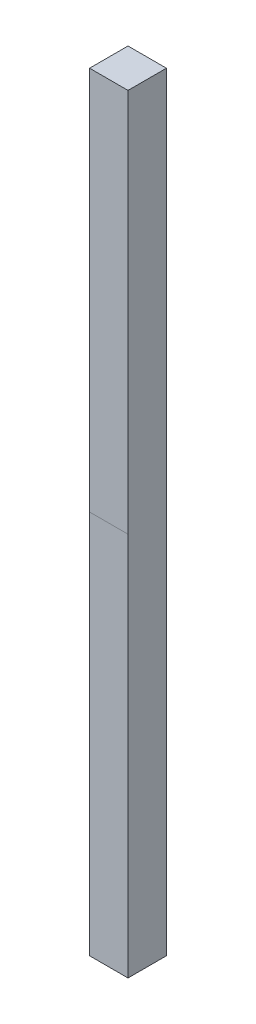
from build123d import *

# Parameters (mm, degrees)
SKETCH1_W      = 25.4
SKETCH1_H      = 25.4
EXTRUDE1_DEPTH = 508


with BuildPart() as part:
    # Sketch1 → Extrude1 (new body)
    with BuildSketch(Plane(origin=(0, 0, 0), x_dir=(1, 0, 0), z_dir=(0, 1, 0))):
        with Locations((12.7, 12.7)):
            Rectangle(SKETCH1_W, SKETCH1_H)
    extrude(amount=EXTRUDE1_DEPTH)


solid = part.part
